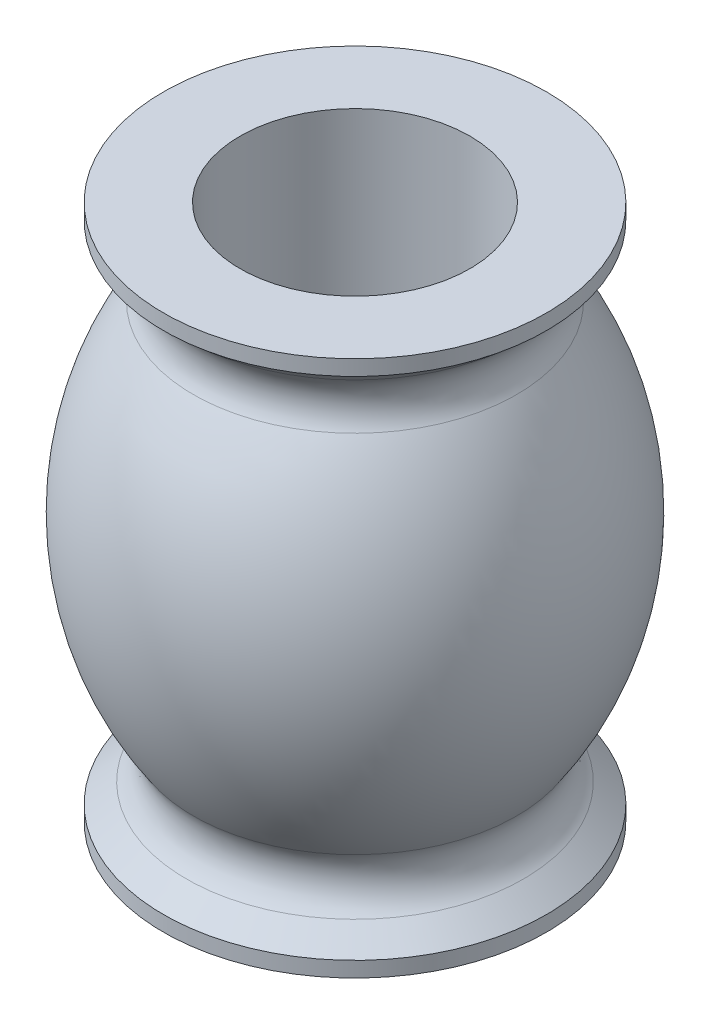
from build123d import *


with BuildPart() as part:
    # 草图1 → 旋转1 (revolve)
    with BuildSketch(Plane.XY, mode=Mode.PRIVATE) as revolve_1_sk:
        with BuildLine():
            Line((2.5, 3.5), (1.5, 3.5))
            Line((1.5, 3.5), (1.5, -3.5))
            Line((1.5, -3.5), (2.5, -3.5))
            Line((2.5, -3.5), (2.5, -3.3))
            Line((2.5, -3.3), (2.199898792, -3.048185187))
            ThreePointArc((2.199898792, -3.048185187), (2.025833101, -2.732393081), (2.109452959, -2.38163499))
            ThreePointArc((2.109452959, -2.38163499), (2.85, 0), (2.109452959, 2.38163499))
            ThreePointArc((2.109452959, 2.38163499), (2.025833101, 2.732393081), (2.199898792, 3.048185187))
            Line((2.199898792, 3.048185187), (2.5, 3.3))
            Line((2.5, 3.3), (2.5, 3.5))
        make_face()
    revolve(revolve_1_sk.sketch.rotate(Axis((0, 3.5, 0), (0, -1, 0)), 270), axis=Axis((0, 3.5, 0), (0, -1, 0)))


solid = part.part
